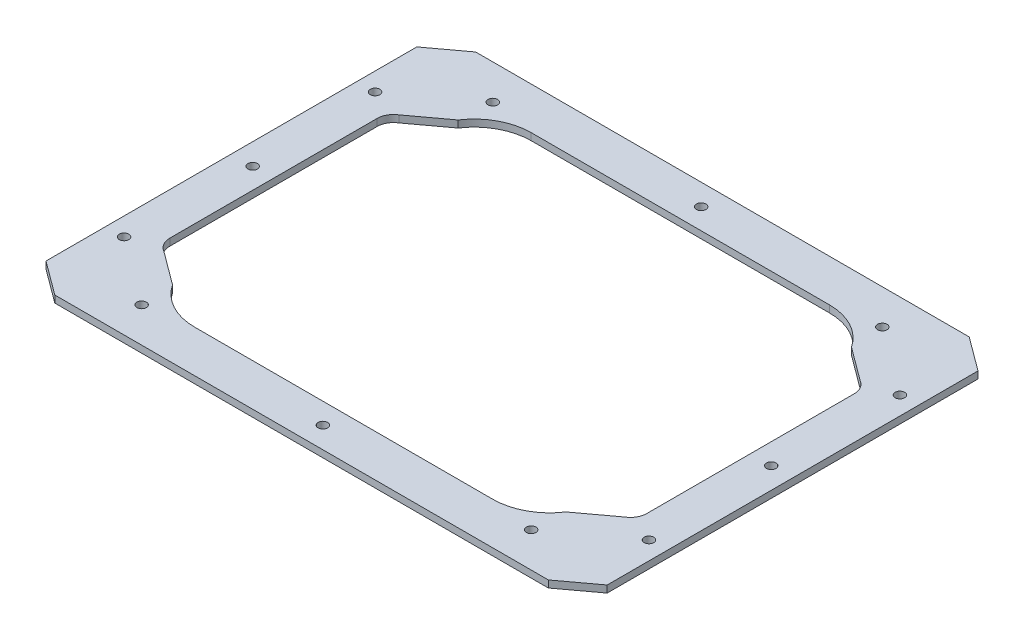
from build123d import *

# Parameters (mm, degrees)
BOSS_EXTRUDE1_DEPTH = 3.175
SKETCH2_R           = 2.159
CUT_EXTRUDE1_DEPTH  = 159.781746826


with BuildPart() as part:
    # Sketch1 → Boss-Extrude1 (new body)
    with BuildSketch(Plane(origin=(0, 0, 0), x_dir=(1, 0, 0), z_dir=(0, 1, 0))):
        Polygon((-111.686526805, 95.25), (-127, 83.918625912), (-127, -83.918625912), (-111.686526805, -95.25), (111.686526805, -95.25), (127, -83.918625912), (127, 83.918625912), (111.686526805, 95.25), align=None)
        with BuildLine():
            Line((-107.95, -46.941679523), (-107.95, 46.941679523))
            ThreePointArc((-107.95, 46.941679523), (-106.983597986, 50.59457048), (-104.337251825, 53.291679523))
            Line((-104.337251825, 53.291679523), (-89.02377863, 64.62305361))
            ThreePointArc((-89.02377863, 64.62305361), (-79.714546423, 73.122295645), (-67.490526817, 76.2))
            Line((-67.490526817, 76.2), (67.490526817, 76.2))
            ThreePointArc((67.490526817, 76.2), (79.714546423, 73.122295645), (89.02377863, 64.62305361))
            Line((89.02377863, 64.62305361), (104.337251825, 53.291679523))
            ThreePointArc((104.337251825, 53.291679523), (106.983597986, 50.59457048), (107.95, 46.941679523))
            Line((107.95, 46.941679523), (107.95, -46.941679523))
            ThreePointArc((107.95, -46.941679523), (106.983597986, -50.59457048), (104.337251825, -53.291679523))
            Line((104.337251825, -53.291679523), (89.02377863, -64.62305361))
            ThreePointArc((89.02377863, -64.62305361), (79.714546423, -73.122295645), (67.490526817, -76.2))
            Line((67.490526817, -76.2), (-67.490526817, -76.2))
            ThreePointArc((-67.490526817, -76.2), (-79.714546423, -73.122295645), (-89.02377863, -64.62305361))
            Line((-89.02377863, -64.62305361), (-104.337251825, -53.291679523))
            ThreePointArc((-104.337251825, -53.291679523), (-106.983597986, -50.59457048), (-107.95, -46.941679523))
        make_face(mode=Mode.SUBTRACT)
    extrude(amount=BOSS_EXTRUDE1_DEPTH)

    # Sketch2 → Cut-Extrude1 (cut, through all)
    with BuildSketch(Plane(origin=(0, 3.175, 0), x_dir=(1, 0, 0), z_dir=(0, 1, 0))):
        with Locations(Location((-88.154790052, 79.46185563, 0), (0, 0, 270))):
            Circle(SKETCH2_R)
        with Locations(Location((88.154790052, 79.46185563, 0), (0, 0, 90))):
            Circle(SKETCH2_R)
        with Locations(Location((88.154790052, -79.46185563, 0), (0, 0, 270))):
            Circle(SKETCH2_R)
        with Locations(Location((-88.154790052, -79.46185563, 0), (0, 0, 90))):
            Circle(SKETCH2_R)
        with Locations(Location((-118.781736441, 56.799107455, 0), (0, 0, 90))):
            Circle(SKETCH2_R)
        with Locations(Location((118.781736441, 56.799107455, 0), (0, 0, 270))):
            Circle(SKETCH2_R)
        with Locations(Location((-118.781736441, -56.799107455, 0), (0, 0, 270))):
            Circle(SKETCH2_R)
        with Locations(Location((118.781736441, -56.799107455, 0), (0, 0, 90))):
            Circle(SKETCH2_R)
        with Locations(Location((0, -85.598, 0), (0, 0, 270))):
            Circle(SKETCH2_R)
        with Locations(Location((0, 85.598, 0), (0, 0, 90))):
            Circle(SKETCH2_R)
        with Locations(Location((-117.348, -0.020516524, 0), (0, 0, 270))):
            Circle(SKETCH2_R)
        with Locations(Location((117.348, -0.020516524, 0), (0, 0, 90))):
            Circle(SKETCH2_R)
    extrude(amount=-CUT_EXTRUDE1_DEPTH, mode=Mode.SUBTRACT)


solid = part.part
